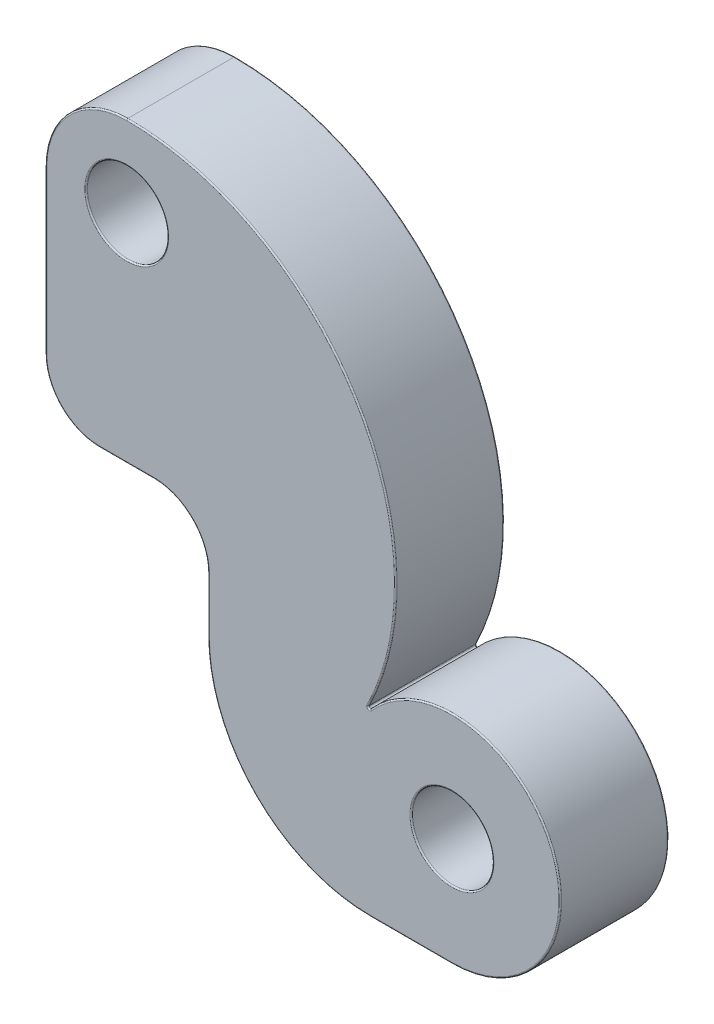
from build123d import *

# Parameters (mm, degrees)
SKETCH1_R           = 7.5
BOSS_EXTRUDE1_DEPTH = 20
FILLET1_R           = 0.25


with BuildPart() as part:
    # Sketch1 → Boss-Extrude1 (new body)
    with BuildSketch(Plane.XY):
        with BuildLine():
            Line((-15, 0), (-15, -30))
            ThreePointArc((-15, -30), (-12.071067812, -37.071067812), (-5, -40))
            Line((-5, -40), (5, -40))
            ThreePointArc((5, -40), (12.071067812, -42.928932188), (15, -50))
            Line((15, -50), (15, -60))
            ThreePointArc((15, -60), (23.786796564, -81.213203436), (45, -90))
            Line((45, -90), (60, -90))
            ThreePointArc((60, -90), (77.364862842, -60.077221233), (42.769230769, -59.846153846))
            ThreePointArc((42.769230769, -59.846153846), (43.10207027, -10.013102703), (0, 15))
            ThreePointArc((0, 15), (-10.606601718, 10.606601718), (-15, 0))
        make_face()
        Circle(SKETCH1_R, mode=Mode.SUBTRACT)
        with Locations((60, -70)):
            Circle(SKETCH1_R, mode=Mode.SUBTRACT)
    extrude(amount=BOSS_EXTRUDE1_DEPTH)

    # Fillet1
    fillet1_edges = [part.edges().sort_by_distance(p)[0] for p in [
        (43.10207027, -10.013102703, 0),
        (77.364862842, -60.077221233, 0),
        (52.5, -90, 0),
        (23.786796564, -81.213203436, 0),
        (15, -55, 0),
        (12.071067812, -42.928932188, 0),
        (0, -40, 0),
        (-12.071067812, -37.071067812, 20),
        (-12.071067812, -37.071067812, 0),
        (-15, -15, 0),
        (-10.606601718, 10.606601718, 0),
        (0, -40, 20),
        (42.769230769, -59.846153846, 10),
        (12.071067812, -42.928932188, 20),
        (15, -55, 20),
        (-7.5, 0, 0),
        (-7.5, 0, 20),
        (23.786796564, -81.213203436, 20),
        (52.5, -70, 0),
        (52.5, -70, 20),
        (52.5, -90, 20),
        (77.364862842, -60.077221233, 20),
        (43.10207027, -10.013102703, 20),
        (-10.606601718, 10.606601718, 20),
        (-15, -15, 20),
    ]]
    fillet(fillet1_edges, radius=FILLET1_R)


solid = part.part
